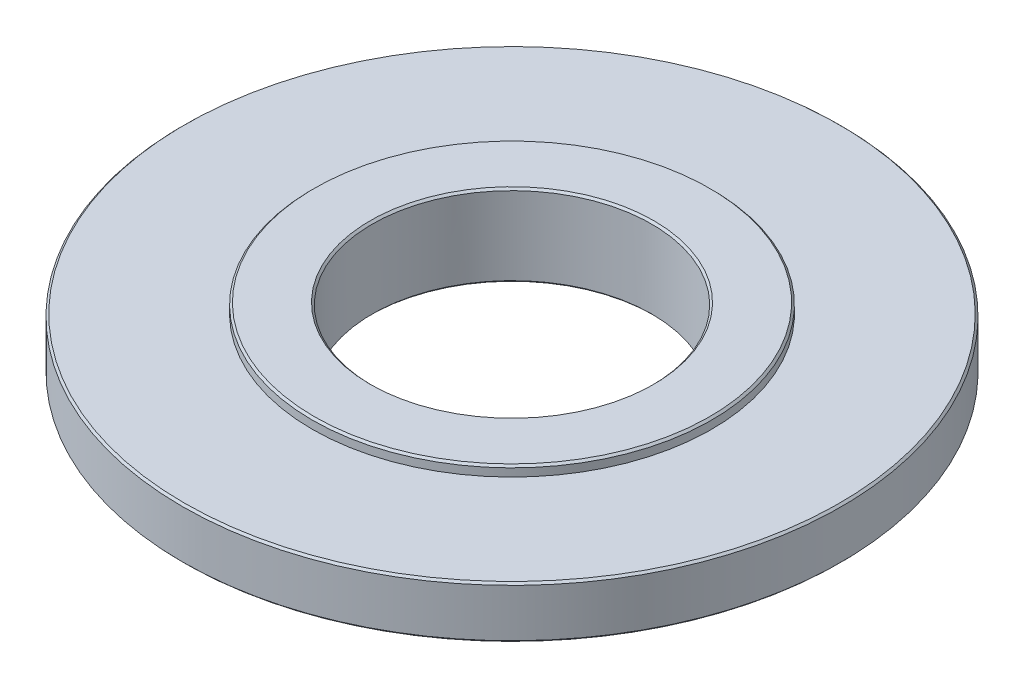
from build123d import *

# Parameters (mm, degrees)
SKETCH_1_W      = 82.5
SKETCH_1_H      = 13
SKETCH_2_R      = 70
EXTRUDE_1_DEPTH = 5
SKETCH_3_R      = 50
EXTRUDE_2_DEPTH = 2.5
HOLE_WIZARD_2_D = 70
CHAMFER_1_SIZE  = 0.5


with BuildPart() as part:
    # 草圖1 → 旋轉1 (revolve)
    with BuildSketch(Plane(origin=(0, 0, 0), x_dir=(-1, 0, 0), z_dir=(0, 0, -1)), mode=Mode.PRIVATE) as revolve_1_sk:
        with Locations((-41.25, 13.5)):
            Rectangle(SKETCH_1_W, SKETCH_1_H)
    revolve(revolve_1_sk.sketch.rotate(Axis((0, 7, 0), (0, 1, 0)), 270), axis=Axis((0, 7, 0), (0, 1, 0)))

    # 草圖2 → 填料-伸長1 (add)
    with BuildSketch(Plane.XZ.offset(-7)):
        with Locations(Location((0, 0, 0), (0, 0, 270))):
            Circle(SKETCH_2_R)
    extrude(amount=EXTRUDE_1_DEPTH)

    # 草圖3 → 填料-伸長2 (add)
    with BuildSketch(Plane(origin=(0, 20, 0), x_dir=(-1, 0, 0), z_dir=(0, 1, 0))):
        with Locations(Location((0, 0, 0), (0, 0, 90))):
            Circle(SKETCH_3_R)
    extrude(amount=EXTRUDE_2_DEPTH)

    # 鑽孔2 (through all)
    with Locations(Plane(origin=(0, 22.5, 0), x_dir=(1, 0, 0), z_dir=(0, 1, 0))):
        with Locations((0, 0)):
            Hole(HOLE_WIZARD_2_D / 2)

    # 導角1
    chamfer_1_edges = [part.edges().sort_by_distance(p)[0] for p in [
        (0, 2, 70),
        (0, 22.5, -50),
        (35, 22.5, 0),
        (35, 2, 0),
        (0, 20, -82.5),
        (0, 7, -82.5),
    ]]
    chamfer(chamfer_1_edges, length=CHAMFER_1_SIZE)


solid = part.part
